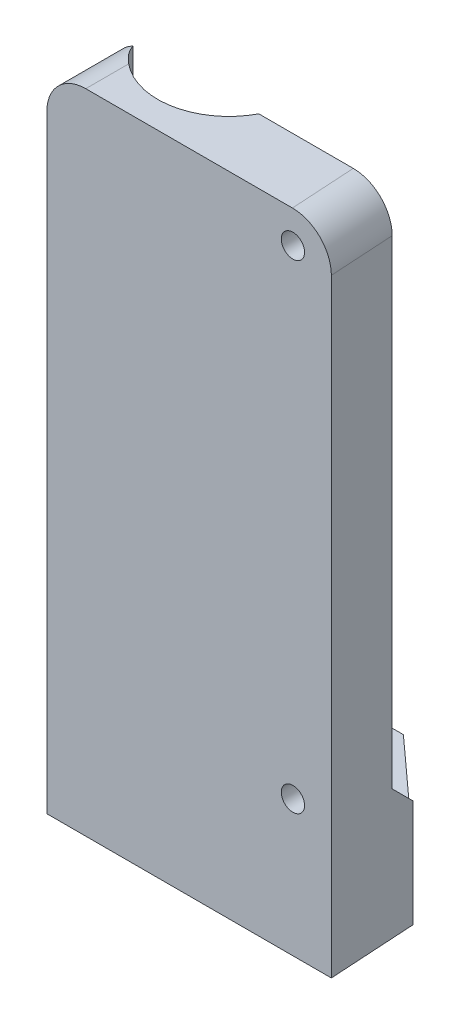
from build123d import *

# Parameters (mm, degrees)
SKETCH1_R               = 3.25
BOSS_EXTRUDE1_DEPTH     = 50
CHAMFER4_SIZE           = 7
CHAMFER4_SIZE2          = 10
SKETCH2_R               = 5.5
CUT_EXTRUDE1_DEPTH      = 45
CUT_EXTRUDE3_DEPTH      = 56.397262251
CUT_EXTRUDE3_DEPTH_BACK = 50
CUT_EXTRUDE4_DEPTH      = 45
CHAMFER5_SIZE           = 5
SKETCH3_R               = 0.9
CUT_EXTRUDE5_DEPTH      = 10
FILLET1_R               = 3


with BuildPart() as part:
    # Sketch1 → Boss-Extrude1 (new body)
    with BuildSketch(Plane(origin=(0, 0, 0), x_dir=(1, 0, 0), z_dir=(0, 1, 0))):
        Polygon((-5.320759509, 8), (-22.469015665, -7.56), (22.469015665, -7.56), (5.320759509, 8), align=None)
        with Locations(Location((0, 0, 0), (0, 0, 270))):
            Circle(SKETCH1_R, mode=Mode.SUBTRACT)
    extrude(amount=BOSS_EXTRUDE1_DEPTH)

    # Chamfer4
    chamfer4_edges = [part.edges().sort_by_distance(p)[0] for p in [
        (22.469015665, 25, 7.56),
    ]]
    chamfer4_side = [part.faces().sort_by_distance(p)[0] for p in [
        (0, 25, 7.56),
    ]]
    chamfer(chamfer4_edges, length=CHAMFER4_SIZE, length2=CHAMFER4_SIZE2, reference=chamfer4_side[0])

    # Sketch2 → Cut-Extrude1 (cut)
    with BuildSketch(Plane(origin=(0, 50, 0), x_dir=(1, 0, 0), z_dir=(0, 1, 0))):
        with Locations(Location((0, 0, 0), (0, 0, 270))):
            Circle(SKETCH2_R)
    extrude(amount=-CUT_EXTRUDE1_DEPTH, mode=Mode.SUBTRACT)

    # Sketch4 → Cut-Extrude3 (cut, two sides: drawn at the far end of the back side and taken through both)
    with BuildSketch(Plane.XZ.offset(-CUT_EXTRUDE3_DEPTH_BACK)):
        with BuildLine():
            Line((-6.5, 0), (-6.5, 8.455296228))
            Line((-6.5, 8.455296228), (-18.092934759, 18.509530088))
            Line((-18.092934759, 18.509530088), (-27.843988074, 13.266508324))
            Line((-27.843988074, 13.266508324), (-26.239796982, -3.957148404))
            Line((-26.239796982, -3.957148404), (-22.051551969, -11.746511534))
            Line((-22.051551969, -11.746511534), (6.44529607, -11.904202977))
            Line((6.44529607, -11.904202977), (12.131507072, -6.5))
            Line((12.131507072, -6.5), (0, -6.5))
            ThreePointArc((0, -6.5), (-4.596194078, -4.596194078), (-6.5, 0))
        make_face()
    extrude(amount=CUT_EXTRUDE3_DEPTH + CUT_EXTRUDE3_DEPTH_BACK, mode=Mode.SUBTRACT)

    # Sketch5 → Cut-Extrude4 (cut)
    with BuildSketch(Plane(origin=(0, 50, 0), x_dir=(1, 0, 0), z_dir=(0, 1, 0))):
        Polygon((0, 0), (4.867894822, -2.56), (20.482845708, -2.56), (8.2569175, 8.380042473), (1.341376292, 8.380042473), (-9.589048862, 8.380042473), (-9.589048862, -2.56), (-4.867894822, -2.56), align=None)
    extrude(amount=-CUT_EXTRUDE4_DEPTH, mode=Mode.SUBTRACT)

    # Chamfer5
    chamfer5_edges = [part.edges().sort_by_distance(p)[0] for p in [
        (10.017520214, 5, 2.56),
        (-5.683947411, 5, 2.56),
    ]]
    chamfer(chamfer5_edges, length=CHAMFER5_SIZE)

    # Sketch3 → Cut-Extrude5 (cut)
    with BuildSketch(Plane.XY.offset(7.56)):
        with Locations((12.5, 47.5)):
            Circle(SKETCH3_R)
        with Locations((12.5, 10.5)):
            Circle(SKETCH3_R)
    extrude(amount=-CUT_EXTRUDE5_DEPTH, mode=Mode.SUBTRACT)

    # Fillet1
    fillet1_edges = [part.edges().sort_by_distance(p)[0] for p in [
        (15.318080635, 50, 5.06),
        (-6.5, 50, 5.06),
    ]]
    fillet(fillet1_edges, radius=FILLET1_R)


solid = part.part
